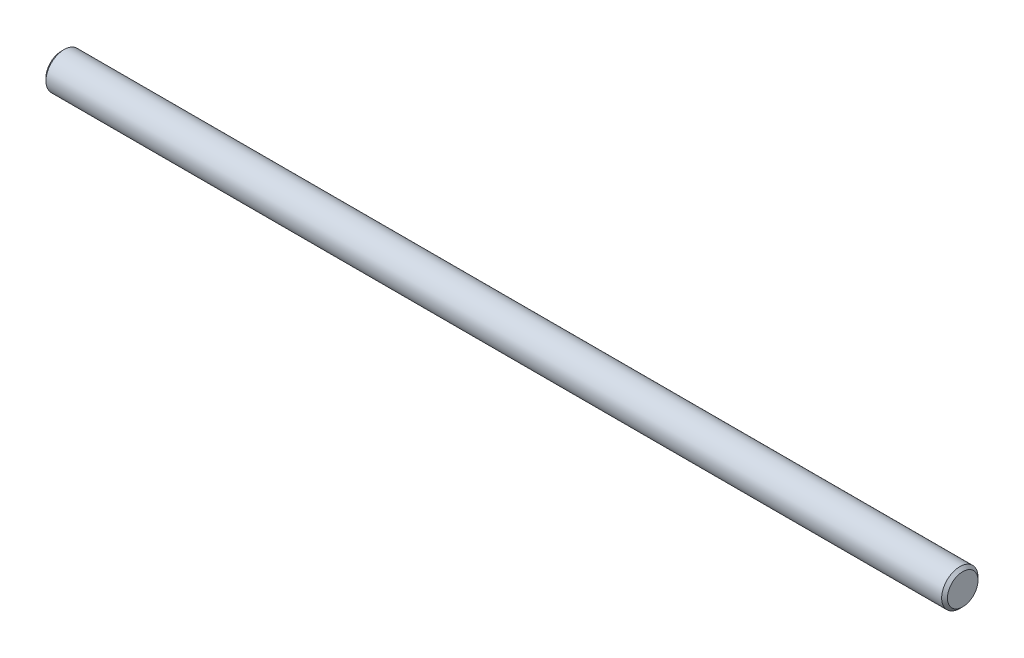
from build123d import *

# Parameters (mm, degrees)
SKETCH1_R           = 12.5
BOSS_EXTRUDE1_DEPTH = 310
CHAMFER1_SIZE       = 2


with BuildPart() as part:
    # Sketch1 → Boss-Extrude1 (new, symmetric)
    with BuildSketch(Plane(origin=(0, 0, 0), x_dir=(0, 0, -1), z_dir=(1, 0, 0))):
        Circle(SKETCH1_R)
    extrude(amount=BOSS_EXTRUDE1_DEPTH, both=True)

    # Chamfer1
    chamfer1_edges = [part.edges().sort_by_distance(p)[0] for p in [
        (-310, 0, 12.5),
        (310, 0, 12.5),
    ]]
    chamfer(chamfer1_edges, length=CHAMFER1_SIZE)


solid = part.part
